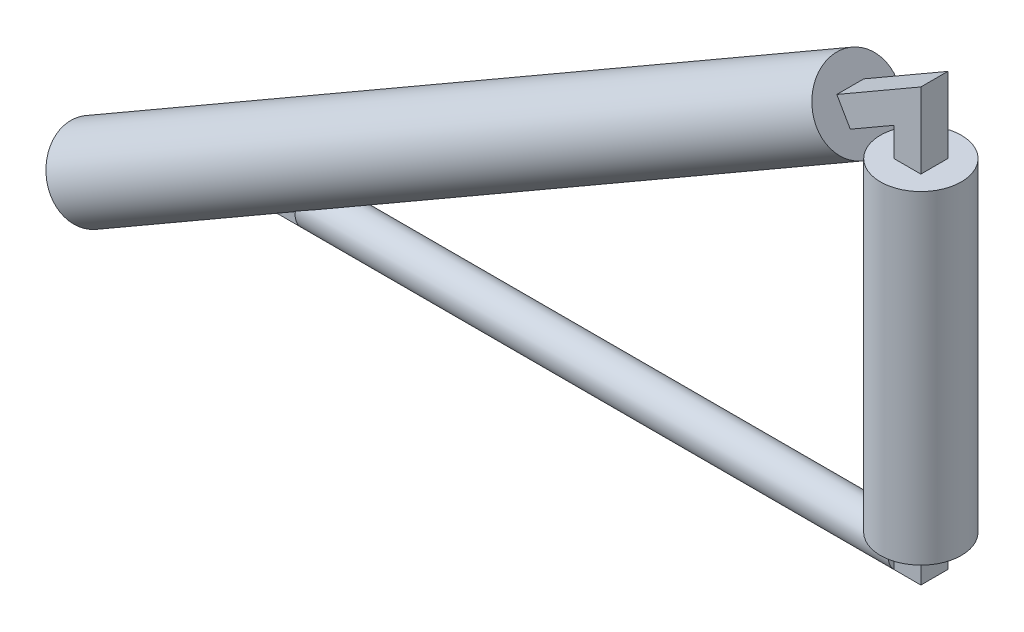
from build123d import *

# Parameters (mm, degrees)
BOSS_EXTRUDE1_DEPTH = 3.175
BOSS_EXTRUDE2_START = -3.175
SKETCH2_R           = 2.24506403
BOSS_EXTRUDE2_DEPTH = 69.85
SKETCH4_R           = 4.7625
BOSS_EXTRUDE4_DEPTH = 19.05
SKETCH5_R           = 4.7625
BOSS_EXTRUDE5_DEPTH = 52.07


with BuildPart() as part:
    # Sketch1 → Boss-Extrude1 (new body)
    with BuildSketch(Plane.XY):
        Polygon((0, 0), (0, 50.8), (-87.988181024, 0), align=None)
        Polygon((-76.13891971, 3.175), (-3.175, 3.175), (-3.175, 45.300738686), align=None, mode=Mode.SUBTRACT)
    extrude(amount=BOSS_EXTRUDE1_DEPTH)

    # Sketch2 → Boss-Extrude2 (add)
    with BuildSketch(Plane(origin=(0, 0, 0), x_dir=(0, 0, -1), z_dir=(1, 0, 0)).offset(BOSS_EXTRUDE2_START)):
        with Locations(Location((-1.5875, 1.5875, 0), (0, 0, 45))):
            Circle(SKETCH2_R)
    extrude(amount=-BOSS_EXTRUDE2_DEPTH)

    # Sketch4 → Boss-Extrude4 (add, symmetric)
    with BuildSketch(Plane(origin=(0, 22.86, 0), x_dir=(-1, 0, 0), z_dir=(0, -1, 0))):
        with Locations(Location((1.5875, -1.5875, 0), (0, 0, 356.177446271))):
            Circle(SKETCH4_R)
    extrude(amount=BOSS_EXTRUDE4_DEPTH, both=True)

    # Sketch5 → Boss-Extrude5 (add, symmetric)
    with BuildSketch(Plane(origin=(-32.995567884, -19.05, 0), x_dir=(0, 0, -1), z_dir=(-0.8660254037844416, -0.49999999999999495, 0))):
        with Locations(Location((-1.5875, -42.406590512, 0), (0, 0, 90))):
            Circle(SKETCH5_R)
    extrude(amount=BOSS_EXTRUDE5_DEPTH, both=True)


solid = part.part
